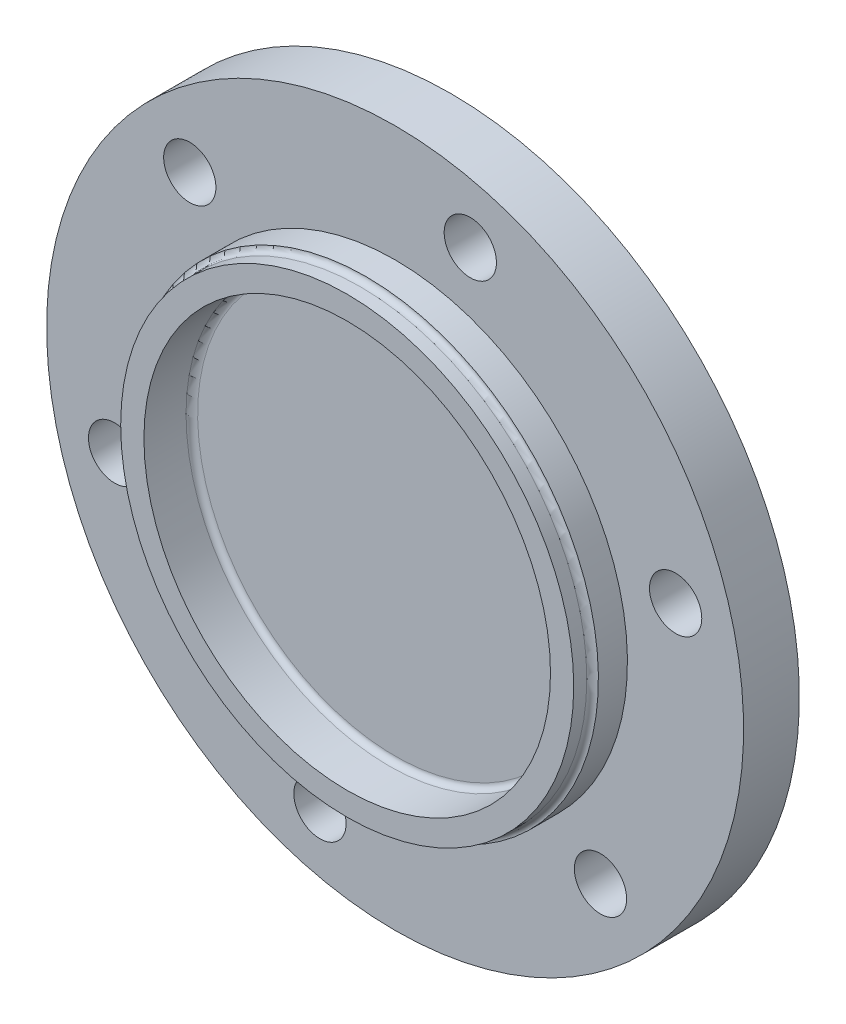
from build123d import *

# Parameters (mm, degrees)
M8_CLEARANCE_HOLE1_D = 9
CIRPATTERN1_COUNT    = 6


with BuildPart() as part:
    # Sketch1 → Revolve1 (revolve)
    with BuildSketch(Plane(origin=(0, 0, 0), x_dir=(0, 0, -1), z_dir=(1, 0, 0))):
        with BuildLine():
            Line((0, 0), (0, 34))
            ThreePointArc((0, 34), (-0.292893219, 34.707106781), (-1, 35))
            Line((-1, 35), (-8.25, 35))
            Line((-8.25, 35), (-8.25, 39))
            Line((-8.25, 39), (-6, 39))
            ThreePointArc((-6, 39), (-5.292893219, 39.292893219), (-5, 40))
            Line((-5, 40), (0, 40))
            Line((0, 40), (0, 60))
            Line((0, 60), (9.6, 60))
            Line((9.6, 60), (9.6, 40))
            Line((9.6, 40), (7.6, 38))
            Line((7.6, 38), (7.6, 0))
            Line((7.6, 0), (0, 0))
        make_face()
    revolve(axis=Axis((0, 0, -9.6), (0, 0, 1)))

    # M8 Clearance Hole1 (through all)
    with Locations(Plane(origin=(0, 0, -9.6), x_dir=(-1, 0, 0), z_dir=(0, 0, -1))):
        with Locations((35.355339059, 35.355339059)):
            m8_clearance_hole1 = Hole(M8_CLEARANCE_HOLE1_D / 2)

    # CirPattern1: M8 Clearance Hole1 ×6 about axis
    cirpattern1_axis = Axis((0, 0, 0), (0, 0, 1))
    for i in range(1, CIRPATTERN1_COUNT):
        add(m8_clearance_hole1.rotate(cirpattern1_axis, i * 360 / CIRPATTERN1_COUNT), mode=Mode.SUBTRACT)


solid = part.part
